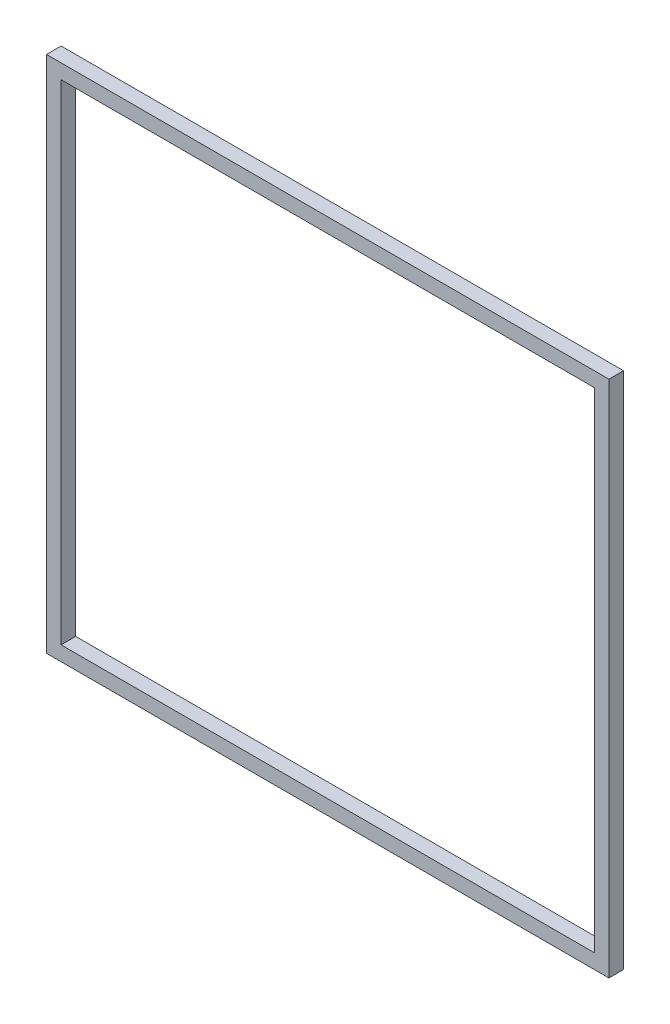
from build123d import *

# Parameters (mm, degrees)
SKETCH1_W           = 770
SKETCH1_H           = 710
SKETCH1_W_2         = 730
SKETCH1_H_2         = 670
BOSS_EXTRUDE1_DEPTH = 20


with BuildPart() as part:
    # Sketch1 → Boss-Extrude1 (new body)
    with BuildSketch(Plane.XY):
        Rectangle(SKETCH1_W, SKETCH1_H)
        Rectangle(SKETCH1_W_2, SKETCH1_H_2, mode=Mode.SUBTRACT)
    extrude(amount=BOSS_EXTRUDE1_DEPTH)


solid = part.part
